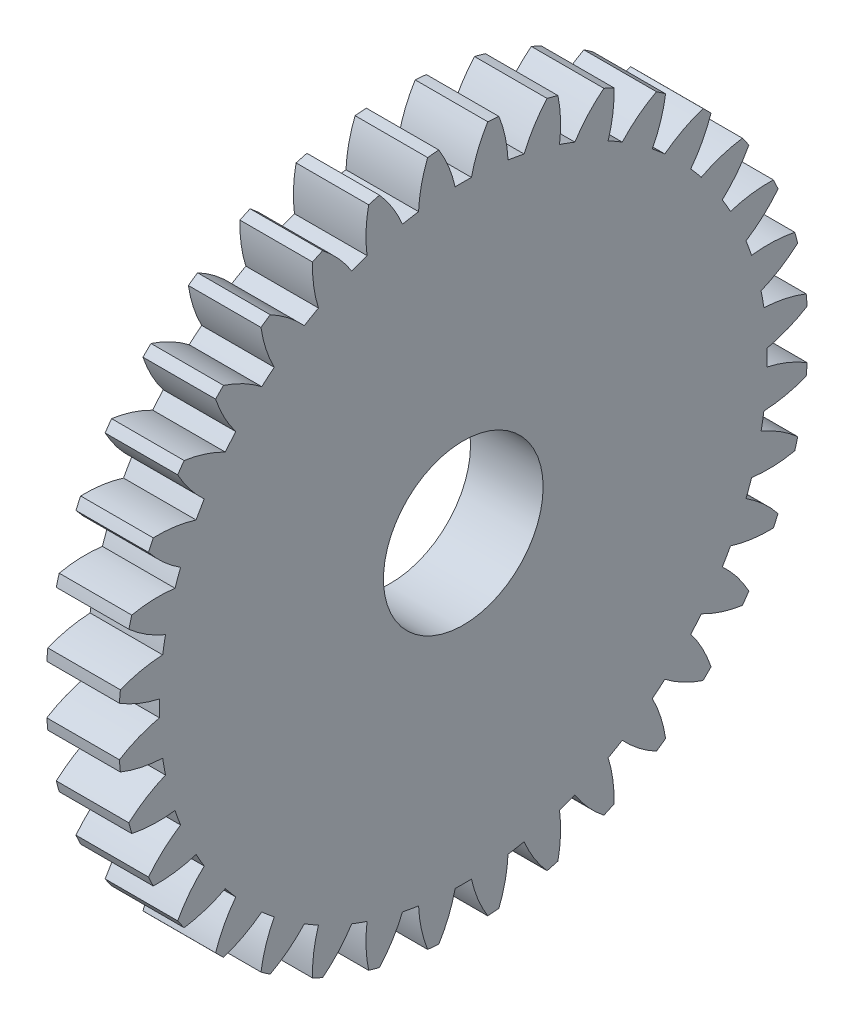
from build123d import *

# Parameters (mm, degrees)
BASPROSKE_W         = 10
BASPROSKE_H         = 47.5
TOOTHCUT_DEPTH      = 68.915388536
TEETHCUTS_COUNT     = 36
TEETHCUTS_ANGLE     = 350
BORSKE_R            = 4
BORE_DEPTH          = 50.0000508
SKETCH_1_R          = 11
CUT_EXTRUDE_1_DEPTH = 10


with BuildPart() as part:
    # BasProSke → Base-Revolve (revolve)
    with BuildSketch(Plane(origin=(0, 0, 0), x_dir=(1, 0, 0), z_dir=(0, 1, 0)), mode=Mode.PRIVATE) as base_revolve_sk:
        with Locations((5, 23.75)):
            Rectangle(BASPROSKE_W, BASPROSKE_H)
    revolve(base_revolve_sk.sketch.rotate(Axis((-10, 0, 0), (1, 0, 0)), 180), axis=Axis((-10, 0, 0), (1, 0, 0)))

    # TooCutSke → ToothCut (cut, through all)
    with BuildSketch(Plane(origin=(0, 0, 0), x_dir=(0, 0, -1), z_dir=(1, 0, 0))):
        with BuildLine():
            ThreePointArc((1.123962761, 41.858912835), (0, 41.874), (-1.123962761, 41.858912835))
            ThreePointArc((-1.123962761, 41.858912835), (-2.022116829, 44.726500229), (-3.384804868, 47.404712225))
            ThreePointArc((-3.384804868, 47.404712225), (0, 47.5254), (3.384804868, 47.404712225))
            ThreePointArc((3.384804868, 47.404712225), (2.022116829, 44.726500229), (1.123962761, 41.858912835))
        make_face()
    toothcut = extrude(amount=TOOTHCUT_DEPTH, mode=Mode.SUBTRACT)

    # TeethCuts: ToothCut ×36 about axis
    teethcuts_axis = Axis((-10, 0, 0), (1, 0, 0))
    for i in range(1, TEETHCUTS_COUNT):
        add(toothcut.rotate(teethcuts_axis, i * TEETHCUTS_ANGLE / (TEETHCUTS_COUNT - 1)), mode=Mode.SUBTRACT)

    # BorSke → Bore (cut, symmetric)
    with BuildSketch(Plane(origin=(0, 0, 0), x_dir=(0, 0, -1), z_dir=(1, 0, 0))):
        with Locations(Location((0, 0, 0), (0, 0, 180))):
            Circle(BORSKE_R)
    extrude(amount=BORE_DEPTH, both=True, mode=Mode.SUBTRACT)

    # 草圖1 → 除料-伸長1 (cut)
    with BuildSketch(Plane(origin=(10, 0, 0), x_dir=(0, 0, -1), z_dir=(1, 0, 0))):
        Circle(SKETCH_1_R)
    extrude(amount=-CUT_EXTRUDE_1_DEPTH, mode=Mode.SUBTRACT)


solid = part.part
